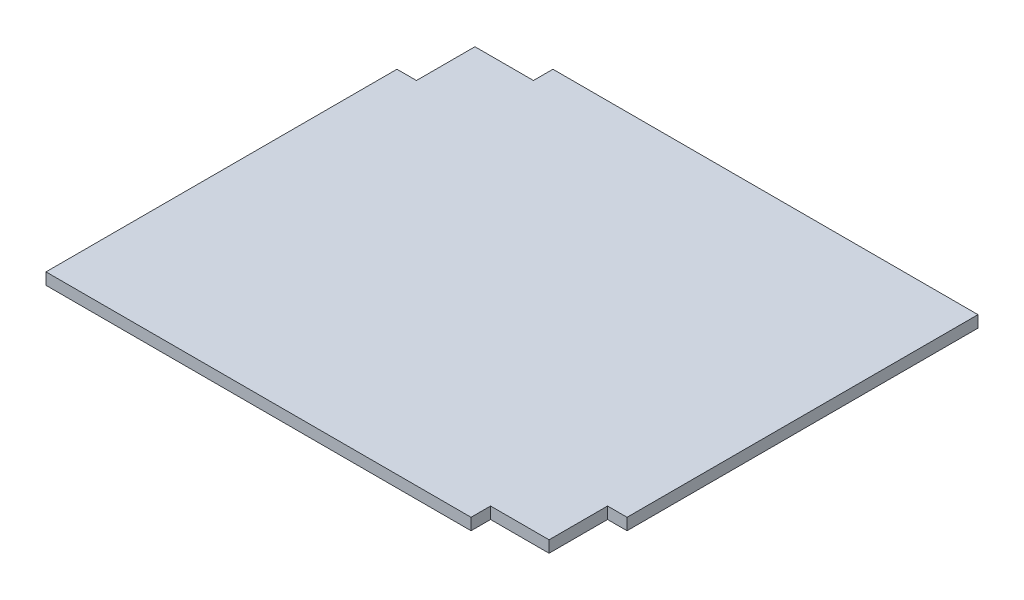
from build123d import *

# Parameters (mm, degrees)
BOSS_EXTRUDE1_DEPTH = 1.5


with BuildPart() as part:
    # Sketch1 → Boss-Extrude1 (new body)
    with BuildSketch(Plane(origin=(0, 0, 0), x_dir=(1, 0, 0), z_dir=(0, 1, 0))):
        Polygon((22.25, -27.5), (22.25, -25), (29.75, -25), (29.75, -17.5), (32.25, -17.5), (32.25, 27.5), (-22.25, 27.5), (-22.25, 25), (-29.75, 25), (-29.75, 17.5), (-32.25, 17.5), (-32.25, -27.5), align=None)
    extrude(amount=BOSS_EXTRUDE1_DEPTH)


solid = part.part
